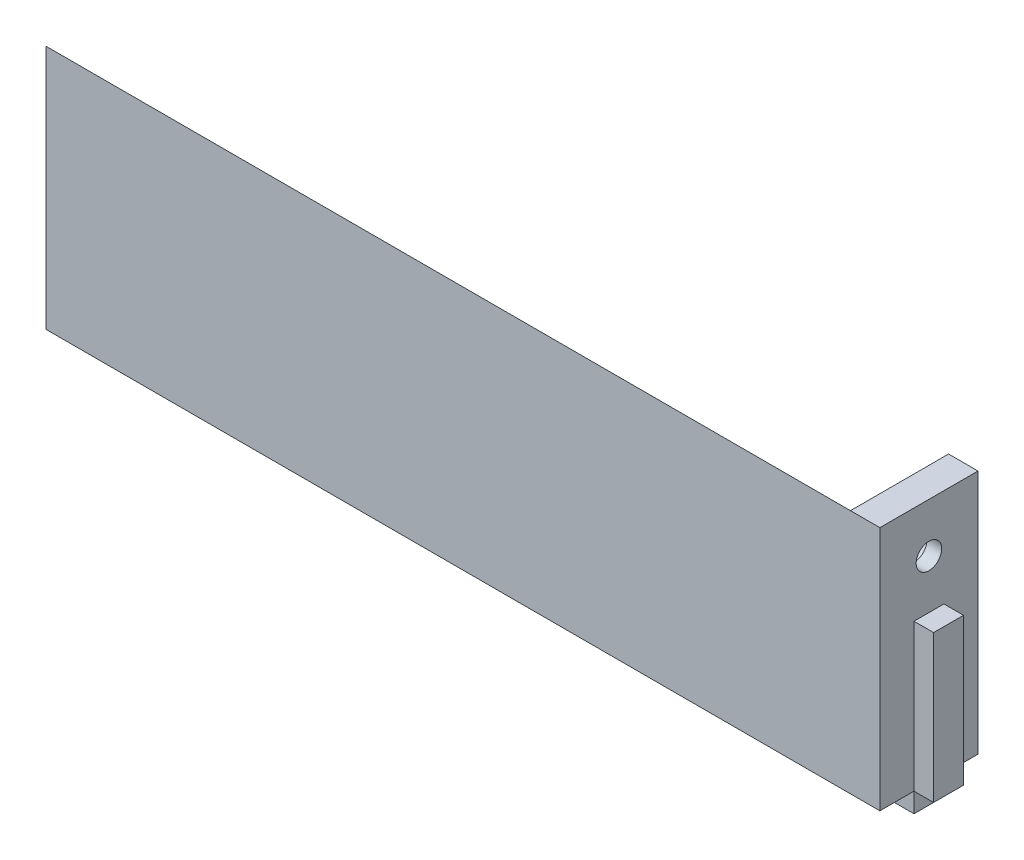
from build123d import *

# Parameters (mm, degrees)
SKETCH_1_W          = 170
SKETCH_1_H          = 20
EXTRUDE_1_DEPTH     = 50
CUT_EXTRUDE_2_DEPTH = 164
SKETCH_3_R          = 5
CUT_EXTRUDE_3_DEPTH = 3
SKETCH_4_R          = 2.6
CUT_EXTRUDE_4_DEPTH = 3
SKETCH_5_W          = 170
SKETCH_5_H          = 20
CUT_EXTRUDE_5_DEPTH = 400
SKETCH_6_R          = 5
CUT_EXTRUDE_6_DEPTH = 400
SKETCH_7_R          = 5
SKETCH_7_R_2        = 2.6
EXTRUDE_2_DEPTH     = 3
SKETCH_8_W          = 35
SKETCH_8_H          = 3.05
SKETCH_8_W_2        = 80
EXTRUDE_3_DEPTH     = 4
SKETCH_9_W          = 6.1
SKETCH_9_H          = 30
EXTRUDE_4_DEPTH     = 4


with BuildPart() as part:
    # 草图1 → 凸台-拉伸1 (new body)
    with BuildSketch(Plane(origin=(0, 0, 0), x_dir=(1, 0, 0), z_dir=(0, 1, 0))):
        with Locations((85, 10)):
            Rectangle(SKETCH_1_W, SKETCH_1_H)
    extrude_1 = extrude(amount=EXTRUDE_1_DEPTH)

    # 草图2 → 切除-拉伸2 (cut)
    with BuildSketch(Plane(origin=(170, 0, 0), x_dir=(0, 0, -1), z_dir=(1, 0, 0))):
        Polygon((0, 50), (20, 0), (20, 50), align=None)
    cut_extrude_2 = extrude(amount=-CUT_EXTRUDE_2_DEPTH, mode=Mode.SUBTRACT)

    # 草图3 → 切除-拉伸3 (cut)
    with BuildSketch(Plane(origin=(6, 0, 0), x_dir=(0, 0, -1), z_dir=(1, 0, 0))):
        with Locations((10, 40)):
            Circle(SKETCH_3_R)
    cut_extrude_3 = extrude(amount=-CUT_EXTRUDE_3_DEPTH, mode=Mode.SUBTRACT)

    # 草图4 → 切除-拉伸4 (cut)
    with BuildSketch(Plane(origin=(3, 0, 0), x_dir=(0, 0, -1), z_dir=(1, 0, 0))):
        with Locations((10, 40)):
            Circle(SKETCH_4_R)
    cut_extrude_4 = extrude(amount=-CUT_EXTRUDE_4_DEPTH, mode=Mode.SUBTRACT)

    # 镜向1: 凸台-拉伸1, 切除-拉伸2, 切除-拉伸3, 切除-拉伸4 across plane
    add(extrude_1.mirror(Plane(origin=(170, 50, 0), x_dir=(0, 0, 1), z_dir=(-1, 0, 0))))
    add(cut_extrude_2.mirror(Plane(origin=(170, 50, 0), x_dir=(0, 0, 1), z_dir=(-1, 0, 0))), mode=Mode.SUBTRACT)
    add(cut_extrude_3.mirror(Plane(origin=(170, 50, 0), x_dir=(0, 0, 1), z_dir=(-1, 0, 0))), mode=Mode.SUBTRACT)
    add(cut_extrude_4.mirror(Plane(origin=(170, 50, 0), x_dir=(0, 0, 1), z_dir=(-1, 0, 0))), mode=Mode.SUBTRACT)

    # 草图5 → 切除-拉伸5 (cut)
    with BuildSketch(Plane.XZ):
        with Locations((85, -10)):
            Rectangle(SKETCH_5_W, SKETCH_5_H)
    extrude(amount=-CUT_EXTRUDE_5_DEPTH, mode=Mode.SUBTRACT)

    # 草图6 → 切除-拉伸6 (cut)
    with BuildSketch(Plane.XZ):
        with Locations(Location((231.37, -10, 0), (0, 0, 270))):
            Circle(SKETCH_6_R)
    extrude(amount=-CUT_EXTRUDE_6_DEPTH, mode=Mode.SUBTRACT)

    # 草图7 → 凸台-拉伸2 (add)
    with BuildSketch(Plane.XZ):
        with Locations(Location((231.37, -10, 0), (0, 0, 270))):
            Circle(SKETCH_7_R)
        with Locations(Location((231.37, -10, 0), (0, 0, 270))):
            Circle(SKETCH_7_R_2, mode=Mode.SUBTRACT)
    extrude(amount=-EXTRUDE_2_DEPTH)

    # 草图8 → 凸台-拉伸3 (add)
    with BuildSketch(Plane.XZ):
        with Locations((187.5, -8.475)):
            Rectangle(SKETCH_8_W, SKETCH_8_H)
        with Locations((187.5, -11.525)):
            Rectangle(SKETCH_8_W, SKETCH_8_H)
        with Locations((300, -8.475)):
            Rectangle(SKETCH_8_W_2, SKETCH_8_H)
        with Locations((300, -11.525)):
            Rectangle(SKETCH_8_W_2, SKETCH_8_H)
    extrude(amount=EXTRUDE_3_DEPTH)

    # 草图9 → 凸台-拉伸4 (add)
    with BuildSketch(Plane(origin=(340, 0, 0), x_dir=(0, 0, -1), z_dir=(1, 0, 0))):
        with Locations((10, 15)):
            Rectangle(SKETCH_9_W, SKETCH_9_H)
    extrude(amount=EXTRUDE_4_DEPTH)


solid = part.part
